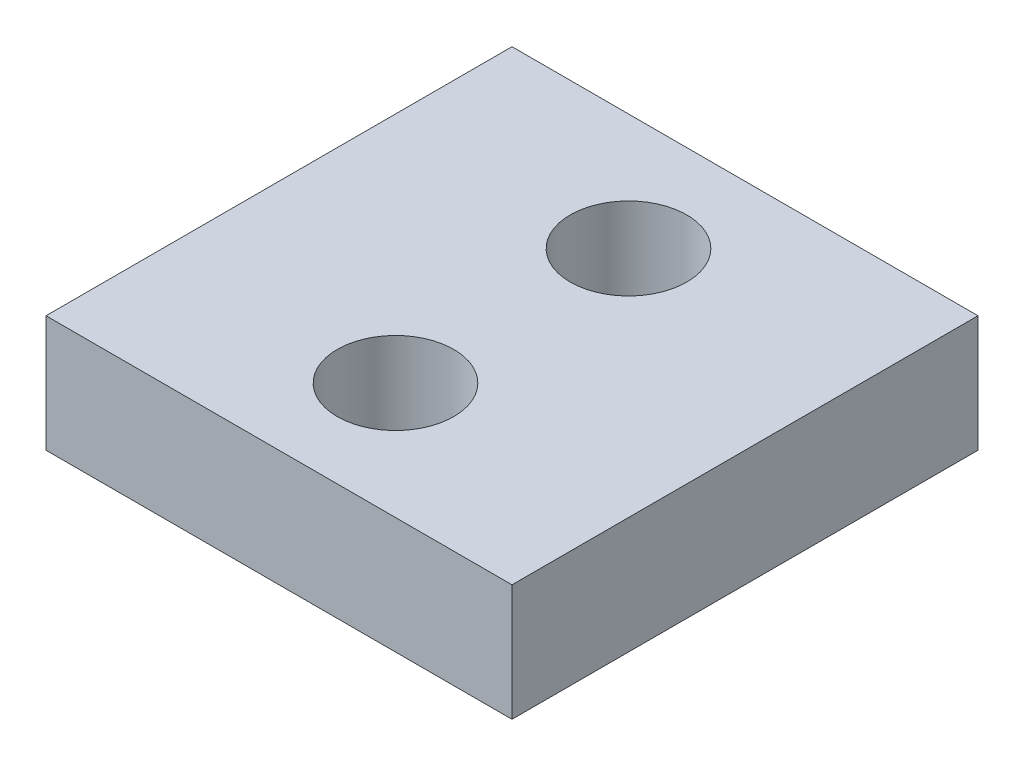
from build123d import *

# Parameters (mm, degrees)
SKETCH1_W                   = 25.4
SKETCH1_H                   = 25.4
BOSS_EXTRUDE1_DEPTH         = 6.35
F_1_4_0_25_DIAMETER_HOLE1_D = 6.35


with BuildPart() as part:
    # Sketch1 → Boss-Extrude1 (new body)
    with BuildSketch(Plane(origin=(0, 0, 0), x_dir=(1, 0, 0), z_dir=(0, 1, 0))):
        Rectangle(SKETCH1_W, SKETCH1_H)
    extrude(amount=BOSS_EXTRUDE1_DEPTH)

    # 1/4 (0.25) Diameter Hole1 (through all)
    with Locations(Plane(origin=(0, 6.35, 0), x_dir=(-1, 0, 0), z_dir=(0, 1, 0))):
        with Locations((0, 6.35), (0, -6.35)):
            Hole(F_1_4_0_25_DIAMETER_HOLE1_D / 2)


solid = part.part
